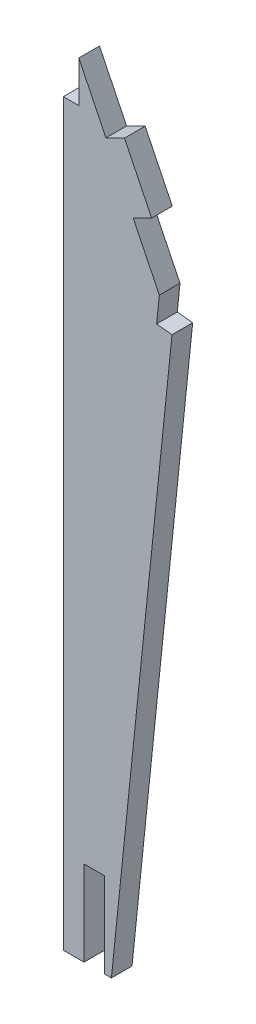
from build123d import *

# Parameters (mm, degrees)
EXTRUDE_1_DEPTH = 2


with BuildPart() as part:
    # 草图1 → 凸台-拉伸1 (new body)
    with BuildSketch(Plane.XY):
        Polygon((18.497649747, 61.197619752), (19.989720249, 61.04358853), (14.114074341, 4.12734925), (13.457776659, 4.12734925), (13.457776659, 12.37734925), (11.457776659, 12.37734925), (11.457776659, 4.12734925), (9.457776659, 4.12734925), (9.457776659, 75.749998121), (10.957776659, 75.749998121), (10.957776659, 79.749998121), (13.588003541, 74.357233843), (15.385591633, 75.233976137), (18.015818513, 69.841211859), (16.218230421, 68.964469566), (18.761202511, 63.750604121), align=None)
    extrude(amount=EXTRUDE_1_DEPTH)


solid = part.part
